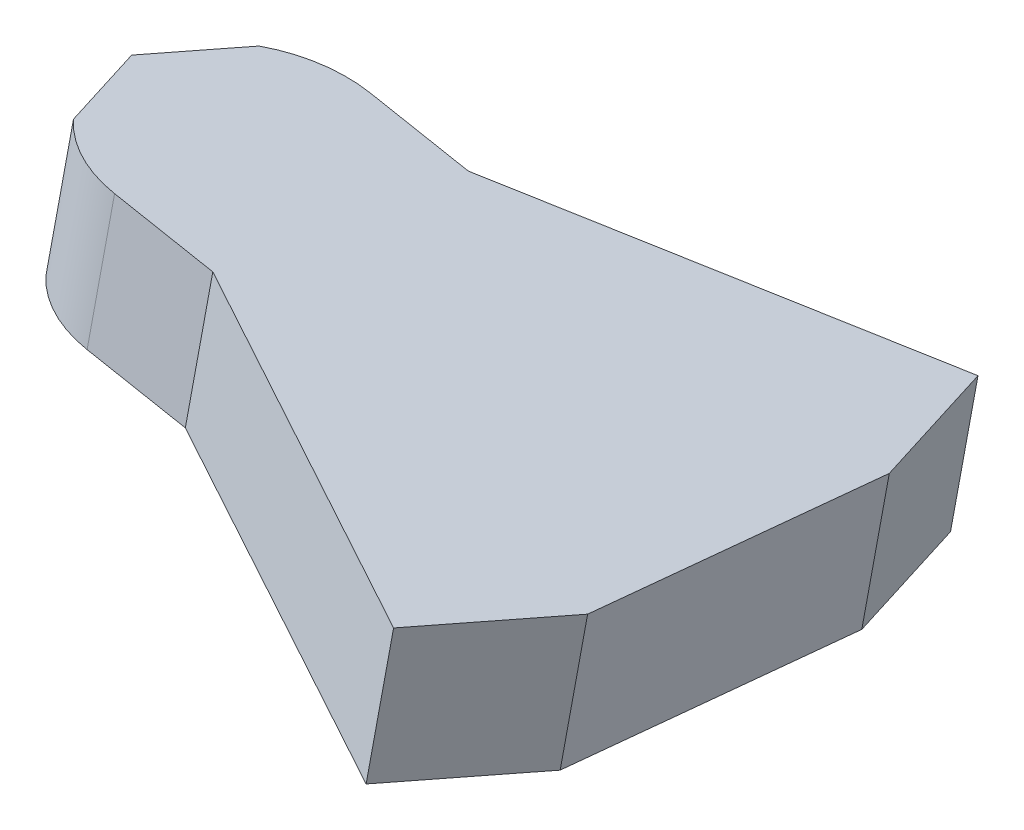
from build123d import *

# Parameters (mm, degrees)
BASE_BODY_DEPTH      = 7.9375
BASE_BODY_DEPTH_BACK = 7.9375


with BuildPart() as part:
    # Sketch36 → base body (new, two sides: drawn at the far end of the back side and taken through both)
    with BuildSketch(Plane(origin=(20.921737804, 196.649439362, -18.857828861), x_dir=(-0.9944387813726006, 0.10483531003395151, -0.010053251825273378), z_dir=(-0.10531623854931917, -0.9898976586232768, 0.09492689476632808)).offset(-BASE_BODY_DEPTH_BACK)):
        with BuildLine():
            Line((502.126358952, -759.009489392), (509.776945736, -773.997260344))
            Line((509.776945736, -773.997260344), (553.695188941, -751.57896131))
            Line((553.695188941, -751.57896131), (566.064134599, -750.762637468))
            ThreePointArc((566.064134599, -750.762637468), (571.160491163, -749.431075239), (575.401507546, -746.307025266))
            Line((575.401507546, -746.307025266), (579.083820389, -735.902974553))
            Line((579.083820389, -735.902974553), (574.066112376, -726.073106528))
            ThreePointArc((574.066112376, -726.073106528), (569.451308261, -723.533521683), (564.224157475, -722.883288763))
            Line((564.224157475, -722.883288763), (551.855211817, -723.699612605))
            Line((551.855211817, -723.699612605), (507.741248901, -708.086327289))
            Line((507.741248901, -708.086327289), (502.126762386, -723.949564583))
            Line((502.126762386, -723.949564583), (502.126358952, -759.009489392))
        make_face()
    extrude(amount=BASE_BODY_DEPTH + BASE_BODY_DEPTH_BACK)


solid = part.part
